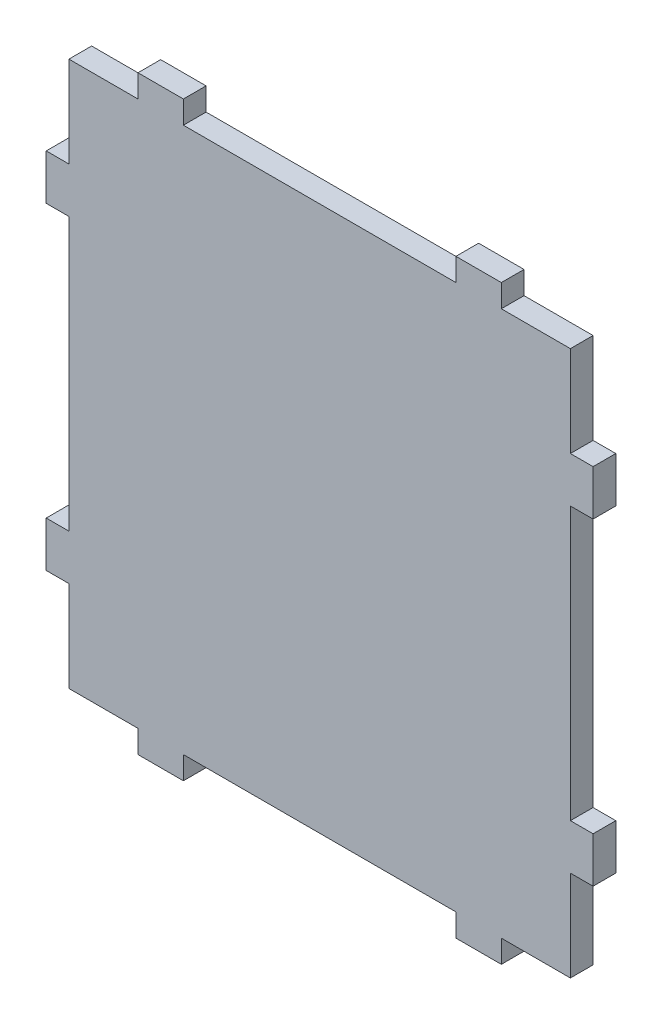
from build123d import *

# Parameters (mm, degrees)
BOSS_EXTRUDE1_DEPTH = 3.175


with BuildPart() as part:
    # Sketch1 → Boss-Extrude1 (new body)
    with BuildSketch(Plane.XY):
        Polygon((16.002, 0), (54.102, 0), (54.102, 3.175), (60.452, 3.175), (60.452, 0), (70.104, 0), (70.104, -12.7), (73.279, -12.7), (73.279, -19.05), (70.104, -19.05), (70.104, -57.15), (73.279, -57.15), (73.279, -63.5), (70.104, -63.5), (70.104, -76.2), (60.452, -76.2), (60.452, -79.375), (54.102, -79.375), (54.102, -76.2), (16.002, -76.2), (16.002, -79.375), (9.652, -79.375), (9.652, -76.2), (0, -76.2), (0, -63.5), (-3.175, -63.5), (-3.175, -57.15), (0, -57.15), (0, -19.05), (-3.175, -19.05), (-3.175, -12.7), (0, -12.7), (0, 0), (9.652, 0), (9.652, 3.175), (16.002, 3.175), align=None)
    extrude(amount=BOSS_EXTRUDE1_DEPTH)


solid = part.part
